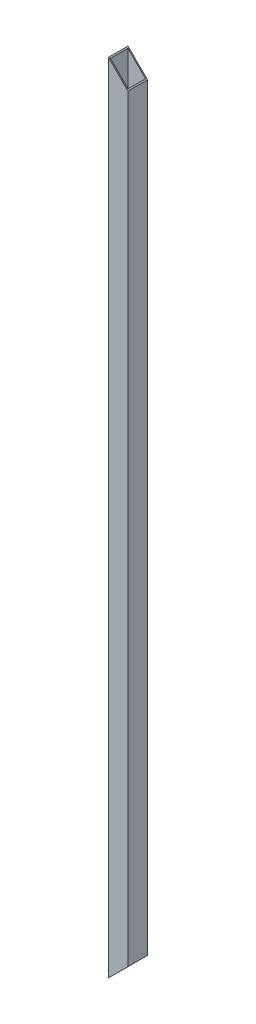
from build123d import *

# Parameters (mm, degrees)
SKETCH2_W           = 40
SKETCH2_H           = 40
SKETCH2_W_2         = 36
SKETCH2_H_2         = 36
BOSS_EXTRUDE1_DEPTH = 1631.5
CUT_EXTRUDE1_REACH  = 1897.948


with BuildPart() as part:
    # Sketch2 → Boss-Extrude1 (new body)
    with BuildSketch(Plane(origin=(0, 1631.5, 0), x_dir=(1, 0, 0), z_dir=(0, 1, 0))):
        with Locations((945, 20)):
            Rectangle(SKETCH2_W, SKETCH2_H)
        with Locations((945, 20)):
            Rectangle(SKETCH2_W_2, SKETCH2_H_2, mode=Mode.SUBTRACT)
    extrude(amount=-BOSS_EXTRUDE1_DEPTH)

    # Cut-Extrude1: up to this face of the body (flat: up to its plane)
    cut_extrude1_end = Plane(part.part.faces().sort_by_distance((945, 815.75, -40))[0])
    # Sketch3 → Cut-Extrude1 (cut, up to the picked face)
    with BuildSketch(Plane.XY, mode=Mode.PRIVATE) as cut_extrude1_sk1:
        Polygon((965, 0), (965, 40), (925, 0), align=None)
    cut_extrude1_tool1 = split(extrude(cut_extrude1_sk1.sketch, amount=-CUT_EXTRUDE1_REACH, mode=Mode.PRIVATE), bisect_by=cut_extrude1_end, keep=Keep.BOTH, mode=Mode.PRIVATE)
    # Sketch3 → Cut-Extrude1 (cut, up to the picked face)
    with BuildSketch(Plane.XY, mode=Mode.PRIVATE) as cut_extrude1_sk2:
        Polygon((965, 1631.5), (925, 1631.5), (965, 1591.5), align=None)
    cut_extrude1_tool2 = split(extrude(cut_extrude1_sk2.sketch, amount=-CUT_EXTRUDE1_REACH, mode=Mode.PRIVATE), bisect_by=cut_extrude1_end, keep=Keep.BOTH, mode=Mode.PRIVATE)
    add(cut_extrude1_tool1.solids().sort_by(Axis((951.666667, 13.333333, 0), (0, 0, -1)))[0], mode=Mode.SUBTRACT)
    add(cut_extrude1_tool2.solids().sort_by(Axis((951.666667, 1618.166667, 0), (0, 0, -1)))[0], mode=Mode.SUBTRACT)


solid = part.part
